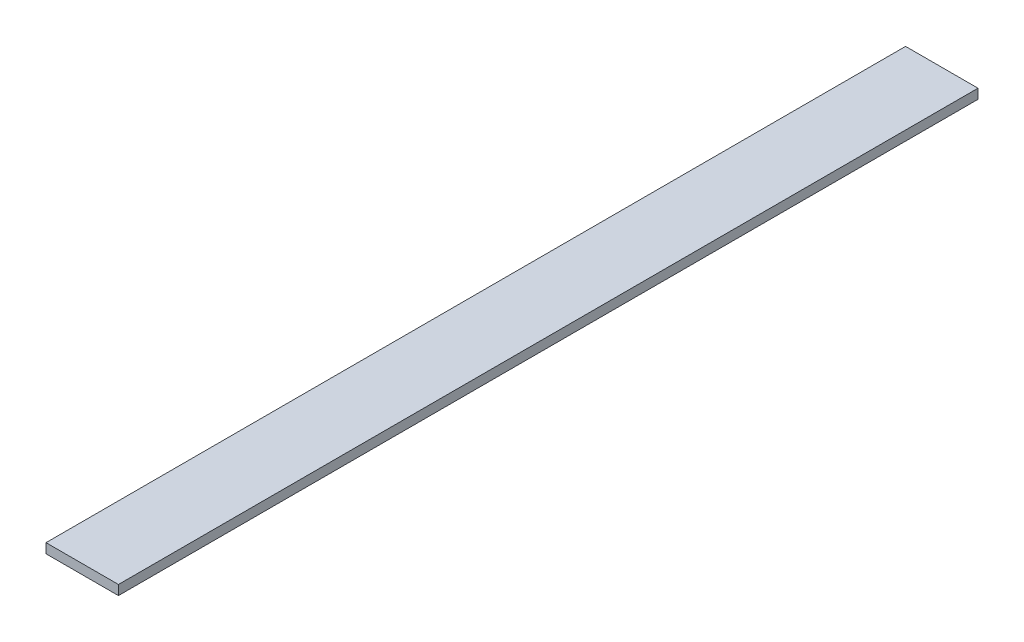
from build123d import *

# Parameters (mm, degrees)
SKETCH1_W           = 15
SKETCH1_H           = 2
BOSS_EXTRUDE1_DEPTH = 178


with BuildPart() as part:
    # Sketch1 → Boss-Extrude1 (new body)
    with BuildSketch(Plane.XY):
        Rectangle(SKETCH1_W, SKETCH1_H)
    extrude(amount=BOSS_EXTRUDE1_DEPTH)


solid = part.part
